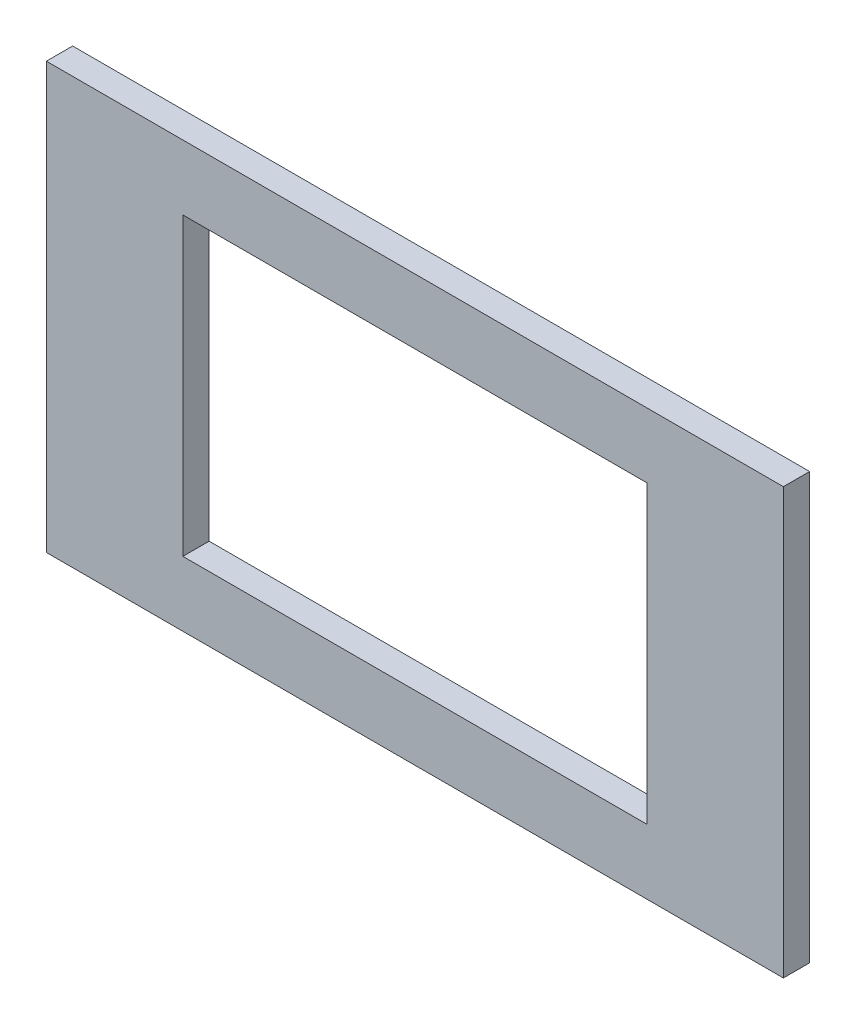
from build123d import *

# Parameters (mm, degrees)
SKETCH1_W           = 140.283392542
SKETCH1_H           = 80.988861008
SKETCH1_W_2         = 88.318253242
SKETCH1_H_2         = 56.283150652
BOSS_EXTRUDE1_DEPTH = 5


with BuildPart() as part:
    # Sketch1 → Boss-Extrude1 (new body)
    with BuildSketch(Plane.XY):
        Rectangle(SKETCH1_W, SKETCH1_H)
        Rectangle(SKETCH1_W_2, SKETCH1_H_2, mode=Mode.SUBTRACT)
    extrude(amount=BOSS_EXTRUDE1_DEPTH)


solid = part.part
